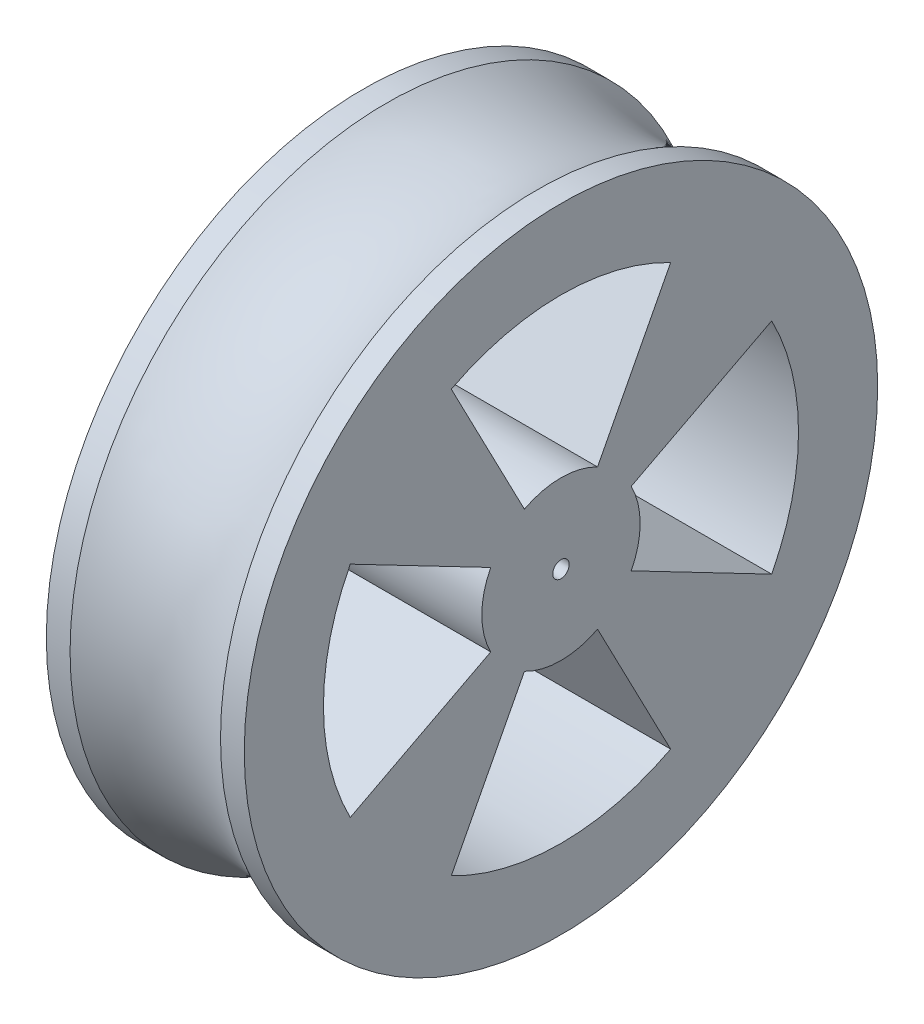
from build123d import *

# Parameters (mm, degrees)
CUT_EXTRUDE1_DEPTH               = 62.846584384
F_2_05_2_08_DIAMETER_HOLE1_D     = 2.08
F_2_05_2_08_DIAMETER_HOLE1_DEPTH = 20
F_2_05_2_08_DIAMETER_HOLE1_TIP   = 0.624895044


with BuildPart() as part:
    # Sketch1 → Revolve1 (revolve)
    with BuildSketch(Plane(origin=(0, 0, 0), x_dir=(1, 0, 0), z_dir=(0, 1, 0)), mode=Mode.PRIVATE) as revolve1_sk:
        with BuildLine():
            Line((-12.5, 0), (12.5, 0))
            Line((12.5, 0), (12.5, 40))
            Line((12.5, 40), (9.5, 40))
            ThreePointArc((9.5, 40), (0, 37.599715907), (-9.5, 40))
            Line((-9.5, 40), (-12.5, 40))
            Line((-12.5, 40), (-12.5, 0))
        make_face()
    revolve(revolve1_sk.sketch.rotate(Axis((-12.5, 0, 0), (1, 0, 0)), 180), axis=Axis((-12.5, 0, 0), (1, 0, 0)))

    # Sketch2 → Cut-Extrude1 (cut, through all)
    with BuildSketch(Plane(origin=(12.5, 0, 0), x_dir=(0, 0, -1), z_dir=(1, 0, 0))):
        with BuildLine():
            Line((-4.617486132, 8.870108332), (-13.852458397, 26.610324995))
            ThreePointArc((-13.852458397, 26.610324995), (0, 30), (13.852458397, 26.610324995))
            Line((13.852458397, 26.610324995), (4.617486132, 8.870108332))
            ThreePointArc((4.617486132, 8.870108332), (0, 10), (-4.617486132, 8.870108332))
        make_face()
        with BuildLine():
            Line((26.610324995, -13.852458397), (8.870108332, -4.617486132))
            ThreePointArc((8.870108332, -4.617486132), (10, 0), (8.870108332, 4.617486132))
            Line((8.870108332, 4.617486132), (26.610324995, 13.852458397))
            ThreePointArc((26.610324995, 13.852458397), (30, 0), (26.610324995, -13.852458397))
        make_face()
        with BuildLine():
            Line((-13.852458397, -26.610324995), (-4.617486132, -8.870108332))
            ThreePointArc((-4.617486132, -8.870108332), (0, -10), (4.617486132, -8.870108332))
            Line((4.617486132, -8.870108332), (13.852458397, -26.610324995))
            ThreePointArc((13.852458397, -26.610324995), (0, -30), (-13.852458397, -26.610324995))
        make_face()
        with BuildLine():
            Line((-26.610324995, 13.852458397), (-8.870108332, 4.617486132))
            ThreePointArc((-8.870108332, 4.617486132), (-10, 0), (-8.870108332, -4.617486132))
            Line((-8.870108332, -4.617486132), (-26.610324995, -13.852458397))
            ThreePointArc((-26.610324995, -13.852458397), (-30, 0), (-26.610324995, 13.852458397))
        make_face()
    extrude(amount=-CUT_EXTRUDE1_DEPTH, mode=Mode.SUBTRACT)

    # Ø2.05 (2.08) Diameter Hole1
    with Locations(Plane(origin=(12.5, 0, 0), x_dir=(0, 0, -1), z_dir=(1, 0, 0))):
        with Locations((0, 0)):
            Hole(F_2_05_2_08_DIAMETER_HOLE1_D / 2, depth=F_2_05_2_08_DIAMETER_HOLE1_DEPTH)
            with Locations((0, 0, -(F_2_05_2_08_DIAMETER_HOLE1_DEPTH + F_2_05_2_08_DIAMETER_HOLE1_TIP / 2))):  # 118° drill point
                Cone(0, F_2_05_2_08_DIAMETER_HOLE1_D / 2, F_2_05_2_08_DIAMETER_HOLE1_TIP, mode=Mode.SUBTRACT)


solid = part.part
